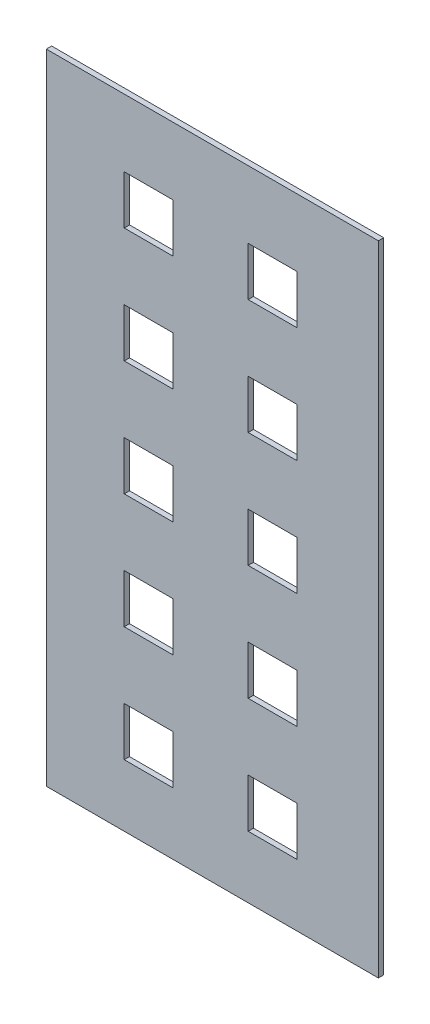
from build123d import *

# Parameters (mm, degrees)
SKETCH1_W           = 183.134
SKETCH1_H           = 95.25
SKETCH1_W_2         = 13.97
SKETCH1_H_2         = 13.97
BOSS_EXTRUDE1_DEPTH = 1.524


with BuildPart() as part:
    # Sketch1 → Boss-Extrude1 (new body)
    with BuildSketch(Plane(origin=(0, 0, 0), x_dir=(0, 1, 0), z_dir=(0, 0, 1))):
        with Locations((91.567, 47.625)):
            Rectangle(SKETCH1_W, SKETCH1_H)
        with Locations((24.765, 65.913)):
            Rectangle(SKETCH1_W_2, SKETCH1_H_2, mode=Mode.SUBTRACT)
        with Locations((57.785, 65.913)):
            Rectangle(SKETCH1_W_2, SKETCH1_H_2, mode=Mode.SUBTRACT)
        with Locations((90.805, 65.913)):
            Rectangle(SKETCH1_W_2, SKETCH1_H_2, mode=Mode.SUBTRACT)
        with Locations((123.825, 65.913)):
            Rectangle(SKETCH1_W_2, SKETCH1_H_2, mode=Mode.SUBTRACT)
        with Locations((156.845, 65.913)):
            Rectangle(SKETCH1_W_2, SKETCH1_H_2, mode=Mode.SUBTRACT)
        with Locations((57.785, 30.353)):
            Rectangle(SKETCH1_W_2, SKETCH1_H_2, mode=Mode.SUBTRACT)
        with Locations((90.805, 30.353)):
            Rectangle(SKETCH1_W_2, SKETCH1_H_2, mode=Mode.SUBTRACT)
        with Locations((123.825, 30.353)):
            Rectangle(SKETCH1_W_2, SKETCH1_H_2, mode=Mode.SUBTRACT)
        with Locations((156.845, 30.353)):
            Rectangle(SKETCH1_W_2, SKETCH1_H_2, mode=Mode.SUBTRACT)
        with Locations((24.765, 30.353)):
            Rectangle(SKETCH1_W_2, SKETCH1_H_2, mode=Mode.SUBTRACT)
    extrude(amount=BOSS_EXTRUDE1_DEPTH)


solid = part.part
